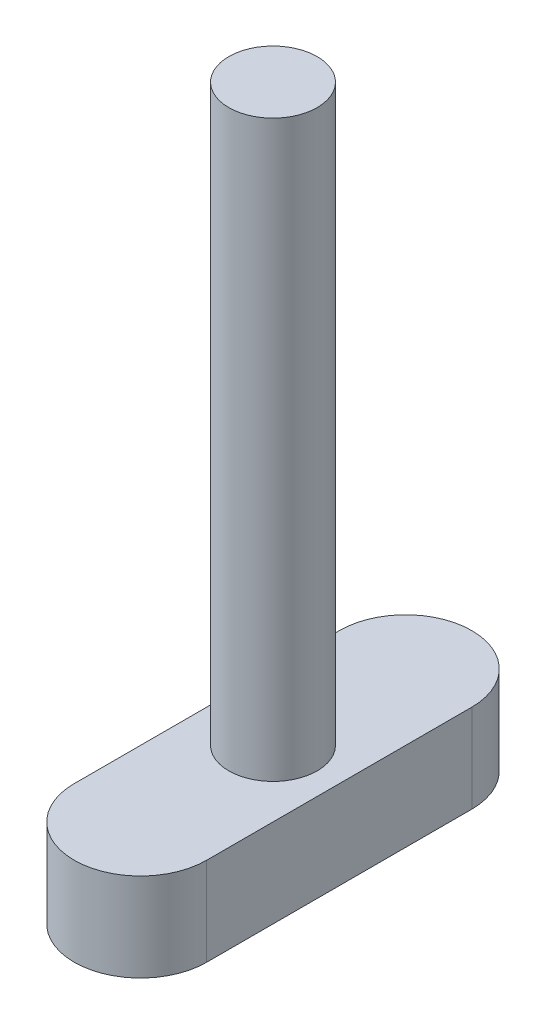
from build123d import *

# Parameters (mm, degrees)
BOSS_EXTRUDE1_DEPTH = 10
SKETCH2_R           = 5
BOSS_EXTRUDE2_DEPTH = 65


with BuildPart() as part:
    # Sketch1 → Boss-Extrude1 (new body)
    with BuildSketch(Plane(origin=(0, 0, 0), x_dir=(1, 0, 0), z_dir=(0, 1, 0))):
        with BuildLine():
            Line((-7.5, -15), (-7.5, 15))
            ThreePointArc((-7.5, 15), (0, 22.5), (7.5, 15))
            Line((7.5, 15), (7.5, -15))
            ThreePointArc((7.5, -15), (0, -22.5), (-7.5, -15))
        make_face()
    extrude(amount=BOSS_EXTRUDE1_DEPTH)

    # Sketch2 → Boss-Extrude2 (add)
    with BuildSketch(Plane(origin=(0, 10, 0), x_dir=(1, 0, 0), z_dir=(0, 1, 0))):
        with Locations(Location((0, 0, 0), (0, 0, 270))):
            Circle(SKETCH2_R)
    extrude(amount=BOSS_EXTRUDE2_DEPTH)


solid = part.part
